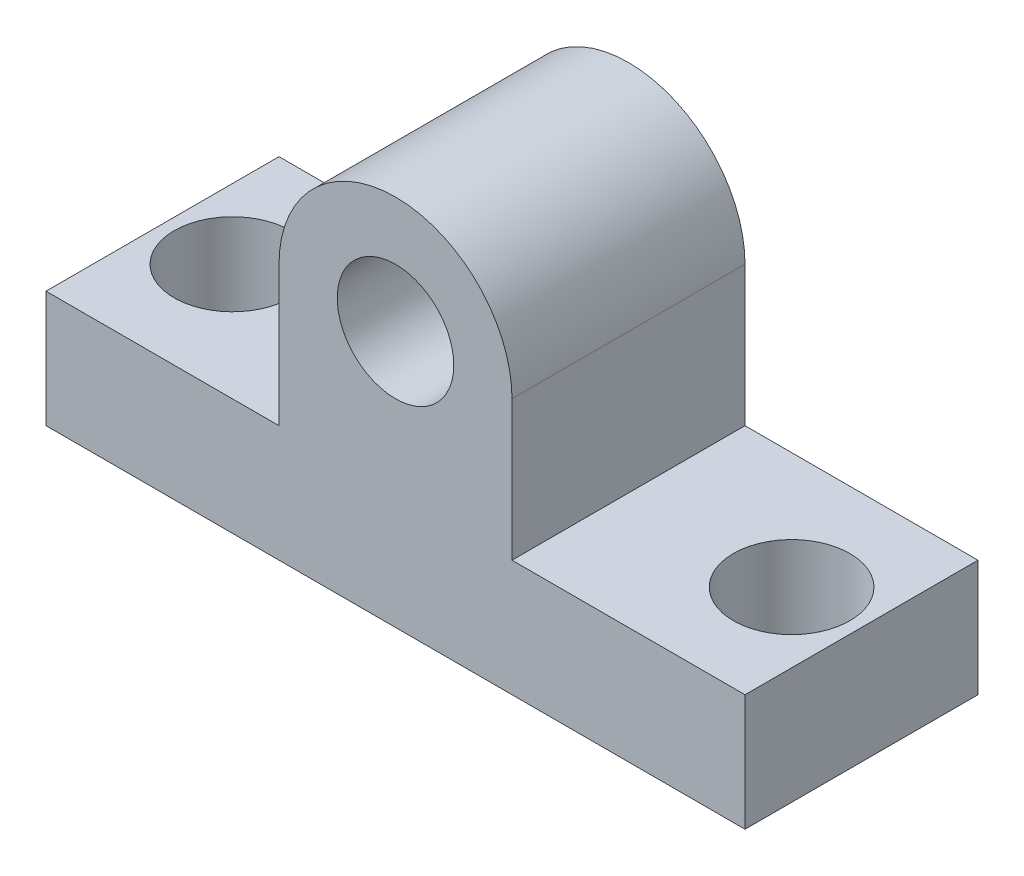
from build123d import *

# Parameters (mm, degrees)
SKETCH_1_R          = 2.5
EXTRUDE_1_DEPTH     = 10
SKETCH_2_R          = 2.5
CUT_EXTRUDE_1_DEPTH = 5
SKETCH_3_R          = 2.5
CUT_EXTRUDE_2_DEPTH = 5


with BuildPart() as part:
    # 草图1 → 凸台-拉伸1 (new body)
    with BuildSketch(Plane.XY):
        with BuildLine():
            Line((5, 0), (15, 0))
            Line((15, 0), (15, -5))
            Line((15, -5), (-15, -5))
            Line((-15, -5), (-15, 0))
            Line((-15, 0), (-5, 0))
            Line((-5, 0), (-5, 6))
            ThreePointArc((-5, 6), (0, 11), (5, 6))
            Line((5, 6), (5, 0))
        make_face()
        with Locations((0, 6)):
            Circle(SKETCH_1_R, mode=Mode.SUBTRACT)
    extrude(amount=EXTRUDE_1_DEPTH)

    # 草图2 → 切除-拉伸1 (cut)
    with BuildSketch(Plane(origin=(0, 0, 0), x_dir=(1, 0, 0), z_dir=(0, 1, 0))):
        with Locations(Location((-12, -5, 0), (0, 0, 180))):
            Circle(SKETCH_2_R)
    extrude(amount=-CUT_EXTRUDE_1_DEPTH, mode=Mode.SUBTRACT)

    # 草图3 → 切除-拉伸2 (cut)
    with BuildSketch(Plane(origin=(0, 0, 0), x_dir=(1, 0, 0), z_dir=(0, 1, 0))):
        with Locations(Location((12, -5, 0), (0, 0, 180))):
            Circle(SKETCH_3_R)
    extrude(amount=-CUT_EXTRUDE_2_DEPTH, mode=Mode.SUBTRACT)


solid = part.part
